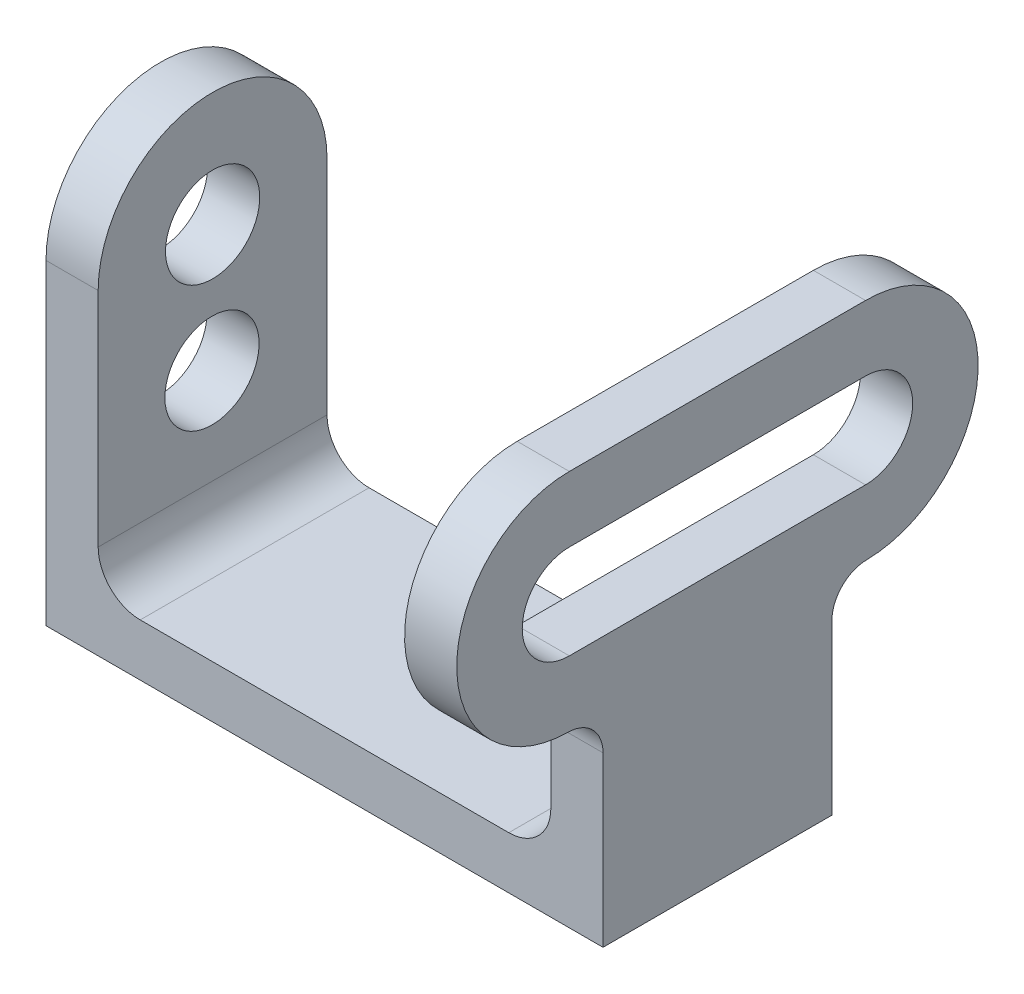
from build123d import *

# Parameters (mm, degrees)
BOSS_EXTRUDE1_DEPTH = 34.544
SKETCH2_R           = 7.112
CUT_EXTRUDE1_DEPTH  = 7.874
BOSS_EXTRUDE2_DEPTH = 7.874
BOSS_EXTRUDE3_DEPTH = 7.874
SKETCH3_3_W         = 34.544
SKETCH3_3_H         = 7.112
CUT_EXTRUDE2_DEPTH  = 34.544
FILLET1_R           = 6.35


with BuildPart() as part:
    # Sketch1 → Boss-Extrude1 (new body)
    with BuildSketch(Plane.XY):
        Polygon((-66.222358974, 33.929598007), (-58.348358974, 33.929598007), (-58.348358974, -5.948401993), (9.977641026, -5.948401993), (9.977641026, 33.929598007), (17.851641026, 33.929598007), (17.851641026, -13.822401993), (-66.222358974, -13.822401993), align=None)
    extrude(amount=-BOSS_EXTRUDE1_DEPTH)

    # Sketch2 → Cut-Extrude1 (cut)
    with BuildSketch(Plane.ZY.offset(66.222358974)):
        with Locations((-17.272, 33.929598007)):
            Circle(SKETCH2_R)
        with Locations((-17.181485908, 14.879598007)):
            Circle(SKETCH2_R)
    extrude(amount=-CUT_EXTRUDE1_DEPTH, mode=Mode.SUBTRACT)

    # Sketch2<3> → Boss-Extrude2 (add)
    with BuildSketch(Plane.ZY.offset(66.222358974)):
        with BuildLine():
            Line((-10.16, 33.929598007), (0, 33.929598007))
            ThreePointArc((0, 33.929598007), (-17.272, 51.201598007), (-34.544, 33.929598007))
            Line((-34.544, 33.929598007), (-24.384, 33.929598007))
            ThreePointArc((-24.384, 33.929598007), (-17.272, 41.041598007), (-10.16, 33.929598007))
        make_face()
    extrude(amount=-BOSS_EXTRUDE2_DEPTH)

    # Sketch3 → Boss-Extrude3 (add)
    with BuildSketch(Plane(origin=(17.851641026, 0, 0), x_dir=(0, 0, -1), z_dir=(1, 0, 0))):
        with BuildLine():
            ThreePointArc((-5.08, 16.93495131), (-5.176663199, 16.935226216), (-5.27332327, 16.936050924))
            ThreePointArc((-5.27332327, 16.936050924), (-1.540900629, 15.352589798), (0, 11.602396048))
            Line((0, 11.602396048), (0, 16.93495131))
            Line((0, 16.93495131), (-5.08, 16.93495131))
        make_face()
        with BuildLine():
            Line((39.624, 50.924244704), (-5.08, 50.924244704))
            ThreePointArc((-5.08, 50.924244704), (-22.074371791, 34.026261206), (-5.27332327, 16.936050924))
            ThreePointArc((-5.27332327, 16.936050924), (-5.176663199, 16.935226216), (-5.08, 16.93495131))
            Line((-5.08, 16.93495131), (0, 16.93495131))
            Line((0, 16.93495131), (0, 26.817598007))
            Line((0, 26.817598007), (-5.08, 26.817598007))
            ThreePointArc((-5.08, 26.817598007), (-12.192, 33.929598007), (-5.08, 41.041598007))
            Line((-5.08, 41.041598007), (39.624, 41.041598007))
            ThreePointArc((39.624, 41.041598007), (46.736, 33.929598007), (39.624, 26.817598007))
            Line((39.624, 26.817598007), (34.544, 26.817598007))
            Line((34.544, 26.817598007), (34.544, 16.93495131))
            Line((34.544, 16.93495131), (39.624, 16.93495131))
            ThreePointArc((39.624, 16.93495131), (39.72066289, 16.935226214), (39.817322653, 16.936050917))
            ThreePointArc((39.817322653, 16.936050917), (56.618371793, 34.026260897), (39.624, 50.924244704))
        make_face()
        with BuildLine():
            ThreePointArc((34.544, 11.602396048), (36.084900412, 15.352589578), (39.817322653, 16.936050917))
            ThreePointArc((39.817322653, 16.936050917), (39.72066289, 16.935226214), (39.624, 16.93495131))
            Line((39.624, 16.93495131), (34.544, 16.93495131))
            Line((34.544, 16.93495131), (34.544, 11.602396048))
        make_face()
    extrude(amount=-BOSS_EXTRUDE3_DEPTH)

    # Sketch3<3> → Cut-Extrude2 (cut)
    with BuildSketch(Plane(origin=(17.851641026, 0, 0), x_dir=(0, 0, -1), z_dir=(1, 0, 0))):
        with Locations((17.272, 30.373598007)):
            Rectangle(SKETCH3_3_W, SKETCH3_3_H)
    extrude(amount=-CUT_EXTRUDE2_DEPTH, mode=Mode.SUBTRACT)

    # Fillet1
    fillet1_edges = [part.edges().sort_by_distance(p)[0] for p in [
        (-58.348358974, -5.948401993, -17.272),
        (9.977641026, -5.948401993, -17.272),
    ]]
    fillet(fillet1_edges, radius=FILLET1_R)


solid = part.part
